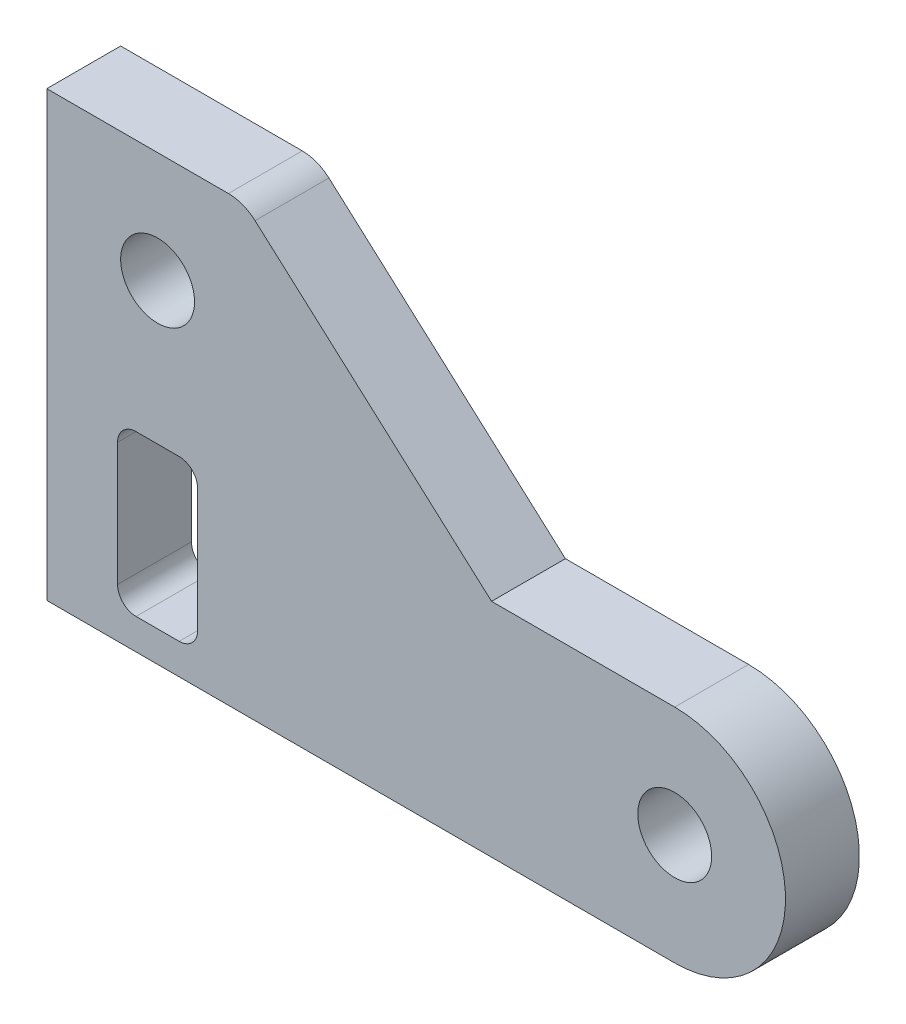
from build123d import *

# Parameters (mm, degrees)
MODEL_R                 = 1.5
SALIENTE_EXTRUIR1_DEPTH = 3


with BuildPart() as part:
    # Model → Saliente-Extruir1 (new body)
    with BuildSketch(Plane.XY):
        with BuildLine():
            Line((182.972853309, 282.646547335), (175.597853309, 282.646547335))
            Line((175.597853309, 282.646547335), (175.597853309, 264.646547335))
            Line((175.597853309, 264.646547335), (201.097853309, 264.646547335))
            ThreePointArc((201.097853309, 264.646547335), (205.597853309, 269.146547335), (201.097853309, 273.646547335))
            Line((201.097853309, 273.646547335), (193.660353309, 273.646547335))
            Line((193.660353309, 273.646547335), (184.055904605, 282.233003026))
            ThreePointArc((184.055904605, 282.233003026), (183.552512477, 282.539644911), (182.972853309, 282.646547335))
        make_face()
        with Locations((201.097853309, 269.146547335)):
            Circle(MODEL_R, mode=Mode.SUBTRACT)
        with Locations((180.097853309, 278.145968764)):
            Circle(MODEL_R, mode=Mode.SUBTRACT)
        with BuildLine():
            Line((179.222853309, 265.896547335), (180.972853309, 265.896547335))
            ThreePointArc((180.972853309, 265.896547335), (181.503183395, 266.116217249), (181.722853309, 266.646547335))
            Line((181.722853309, 266.646547335), (181.722853309, 271.646547335))
            ThreePointArc((181.722853309, 271.646547335), (181.503183395, 272.176877421), (180.972853309, 272.396547335))
            Line((180.972853309, 272.396547335), (179.222853309, 272.396547335))
            ThreePointArc((179.222853309, 272.396547335), (178.692523223, 272.176877421), (178.472853309, 271.646547335))
            Line((178.472853309, 271.646547335), (178.472853309, 266.646547335))
            ThreePointArc((178.472853309, 266.646547335), (178.692523223, 266.116217249), (179.222853309, 265.896547335))
        make_face(mode=Mode.SUBTRACT)
    extrude(amount=SALIENTE_EXTRUIR1_DEPTH)


solid = part.part
